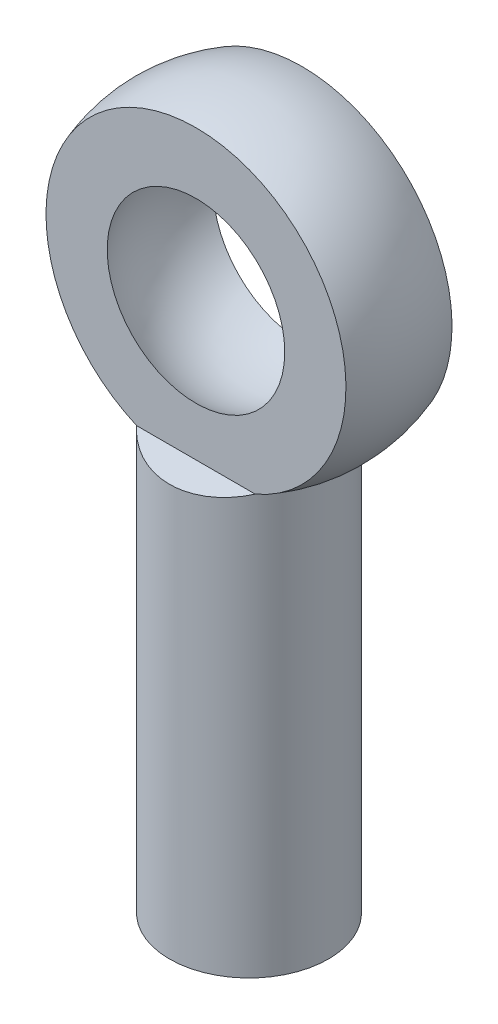
from build123d import *

# Parameters (mm, degrees)
SKETCH3_R           = 3
BOSS_EXTRUDE1_DEPTH = 21
CUT_EXTRUDE1_DEPTH  = 5
SKETCH6_R           = 1.6
CUT_EXTRUDE2_DEPTH  = 10


with BuildPart() as part:
    # Sketch1 → Revolve1 (revolve)
    with BuildSketch(Plane(origin=(0, 0, 0), x_dir=(1, 0, 0), z_dir=(0, 1, 0))):
        with BuildLine():
            Line((0, 2), (0, -2))
            Line((0, -2), (5.656854249, -2))
            ThreePointArc((5.656854249, -2), (6, 0), (5.656854249, 2))
            Line((5.656854249, 2), (0, 2))
        make_face()
    revolve(axis=Axis((0, 0, -2), (0, 0, 1)))

    # Sketch3 → Boss-Extrude1 (add)
    with BuildSketch(Plane(origin=(0, 0, 0), x_dir=(1, 0, 0), z_dir=(0, 1, 0))):
        with Locations(Location((0, 0, 0), (0, 0, 270))):
            Circle(SKETCH3_R)
    extrude(amount=-BOSS_EXTRUDE1_DEPTH)

    # Sketch4 → Cut-Revolve2 (revolve, cut)
    with BuildSketch(Plane(origin=(0, 0, 0), x_dir=(1, 0, 0), z_dir=(0, 1, 0))):
        with BuildLine():
            Line((0, 3.9), (0, -3.9))
            ThreePointArc((0, -3.9), (3.9, 0), (0, 3.9))
        make_face()
    revolve(axis=Axis((0, 0, -3.9), (0, 0, 1)), mode=Mode.SUBTRACT)

    # Sketch5 → Cut-Extrude1 (cut, symmetric)
    with BuildSketch(Plane(origin=(0, 0, 0), x_dir=(0, 0, -1), z_dir=(1, 0, 0))):
        Polygon((2, -5.196152423), (3, -5.491987159), (3, -2.491987159), (2, -2.491987159), align=None)
        Polygon((-2, -2.491987159), (-3, -2.491987159), (-3, -5.491987159), (-2, -5.196152423), align=None)
    extrude(amount=CUT_EXTRUDE1_DEPTH, both=True, mode=Mode.SUBTRACT)

    # Sketch6 → Cut-Extrude2 (cut)
    with BuildSketch(Plane.XZ.offset(21)):
        with Locations(Location((0, 0, 0), (0, 0, 270))):
            Circle(SKETCH6_R)
    extrude(amount=-CUT_EXTRUDE2_DEPTH, mode=Mode.SUBTRACT)


solid = part.part
